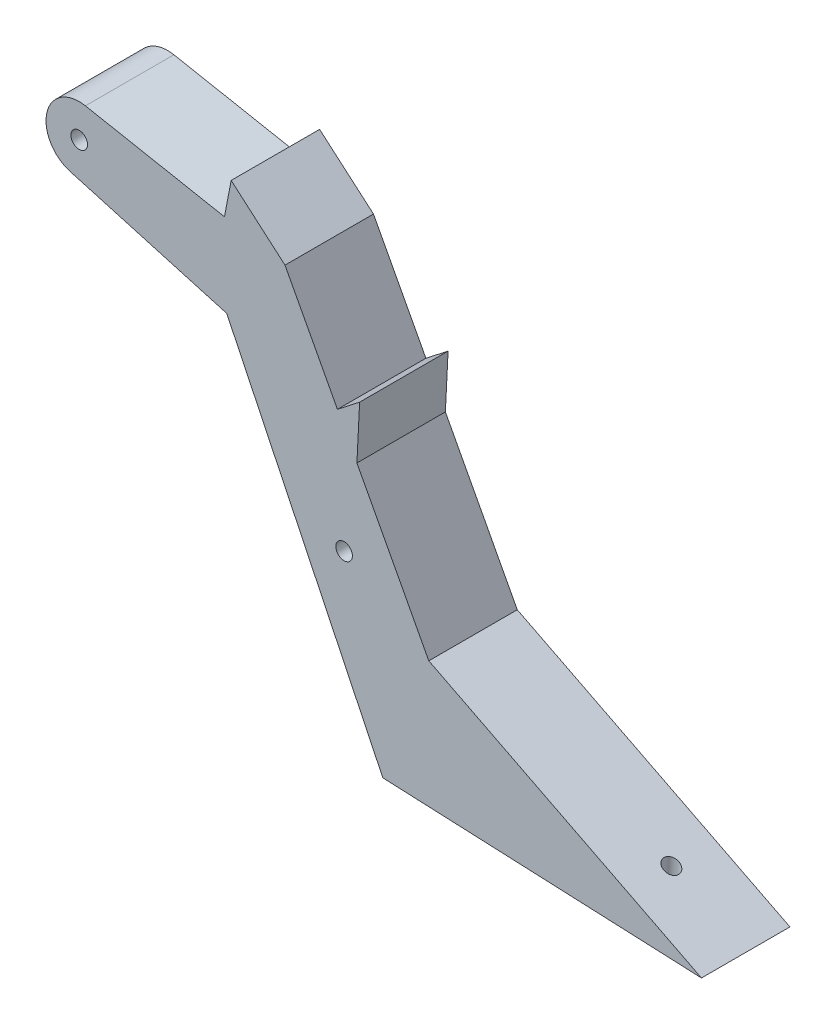
from build123d import *

# Parameters (mm, degrees)
SKETCH_1_R          = 1.5
EXTRUDE_1_DEPTH     = 16
SKETCH_2_R          = 1.35
CUT_EXTRUDE_1_DEPTH = 10
CUT_EXTRUDE_2_DEPTH = 33
EXTRUDE_3_DEPTH     = 16
SKETCH_6_R          = 1.5
CUT_EXTRUDE_3_DEPTH = 48
EXTRUDE_4_DEPTH     = 16


with BuildPart() as part:
    # 草图1 → 凸台-拉伸1 (new body)
    with BuildSketch(Plane.XY):
        with BuildLine():
            Line((1.126380295, 5.893323971), (37.220974686, -1.005370225))
            Line((37.220974686, -1.005370225), (63.227984205, -49.979924472))
            Line((63.227984205, -49.979924472), (112.538061605, -75))
            Line((112.538061605, -75), (53.330616959, -72.391905084))
            Line((53.330616959, -72.391905084), (49.915441771, -64.88738307))
            Line((49.915441771, -64.88738307), (26.682733599, -13.835720919))
            Line((26.682733599, -13.835720919), (-1.643050648, -5.77064854))
            ThreePointArc((-1.643050648, -5.77064854), (-5.837705093, 1.386073321), (1.126380295, 5.893323971))
        make_face()
        Circle(SKETCH_1_R, mode=Mode.SUBTRACT)
    extrude(amount=EXTRUDE_1_DEPTH)

    # 草图2 → 切除-拉伸1 (cut)
    with BuildSketch(Plane(origin=(-3.079413203, -69.907036606, 0), x_dir=(0.9990312032291818, -0.044007442262116094, 0), z_dir=(-0.044007442262116094, -0.9990312032291818, 0))):
        with Locations((66, 8)):
            Circle(SKETCH_2_R)
        with Locations((102, 8)):
            Circle(SKETCH_2_R)
        with Locations((84, 8)):
            Circle(SKETCH_2_R)
    extrude(amount=-CUT_EXTRUDE_1_DEPTH, mode=Mode.SUBTRACT)

    # 草图3 → 切除-拉伸2 (cut)
    with BuildSketch(Plane.XY.offset(16)):
        Polygon((26.682733599, -13.835720919), (54.911117554, -72.461526322), (53.330616959, -72.391905084), align=None)
    extrude(amount=-CUT_EXTRUDE_2_DEPTH, mode=Mode.SUBTRACT)

    # 草图5 → 凸台-拉伸3 (add)
    with BuildSketch(Plane(origin=(0, 0, 0), x_dir=(-1, 0, 0), z_dir=(0, 0, -1))):
        Polygon((-37.220974686, -1.005370225), (-27.480137518, 7.389214918), (-26.275532527, 1.086612233), align=None)
    extrude(amount=-EXTRUDE_3_DEPTH)

    # 草图6 → 切除-拉伸3 (cut)
    with BuildSketch(Plane(origin=(0, 0, 0), x_dir=(-1, 0, 0), z_dir=(0, 0, -1))):
        with Locations((-47.911117554, -40.461526322)):
            Circle(SKETCH_6_R)
    extrude(amount=-CUT_EXTRUDE_3_DEPTH, mode=Mode.SUBTRACT)

    # 草图7 → 凸台-拉伸4 (add)
    with BuildSketch(Plane.XY.offset(16)):
        Polygon((46.698574744, -18.852913898), (50.712719625, -15.723743191), (50.224479445, -25.492647349), align=None)
    extrude(amount=-EXTRUDE_4_DEPTH)


solid = part.part
